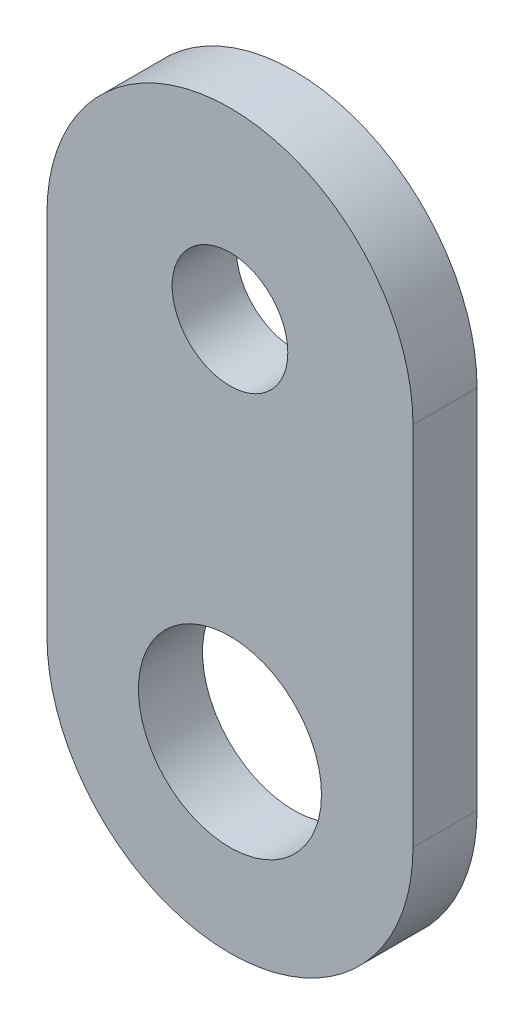
from build123d import *

# Parameters (mm, degrees)
BOSS_EXTRUDE1_DEPTH = 8.89
SKETCH2_R           = 12.7
SKETCH2_R_2         = 8.0264
CUT_EXTRUDE2_DEPTH  = 93.011478088


with BuildPart() as part:
    # Sketch1 → Boss-Extrude1 (new body)
    with BuildSketch(Plane.XY):
        with BuildLine():
            Line((0, 0), (0, 50.8))
            ThreePointArc((0, 50.8), (25.4, 76.2), (50.8, 50.8))
            Line((50.8, 50.8), (50.8, 0))
            ThreePointArc((50.8, 0), (25.4, -25.4), (0, 0))
        make_face()
    extrude(amount=BOSS_EXTRUDE1_DEPTH)

    # Sketch2 → Cut-Extrude2 (cut, through all)
    with BuildSketch(Plane.XY.offset(8.89)):
        with Locations((25.4, 0)):
            Circle(SKETCH2_R)
        with Locations((25.4, 50.8)):
            Circle(SKETCH2_R_2)
    extrude(amount=-CUT_EXTRUDE2_DEPTH, mode=Mode.SUBTRACT)


solid = part.part
